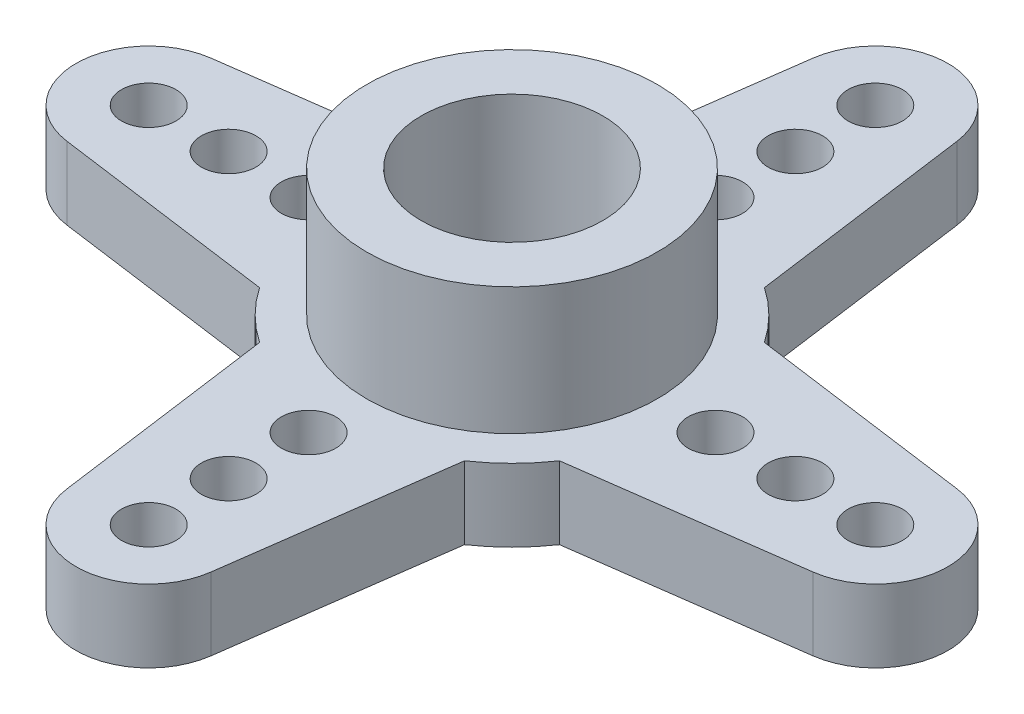
from build123d import *

# Parameters (mm, degrees)
ESBO_O2_R                = 0.75
RESSALTO_EXTRUS_O1_DEPTH = 2
PADR_OCIRCULAR1_COUNT    = 4
ESBO_O3_R                = 4
ESBO_O3_R_2              = 2.5
RESSALTO_EXTRUS_O2_DEPTH = 3.5
CORTE_EXTRUS_O1_START    = -1
ESBO_O4_R                = 2.5
ESBO_O4_R_2              = 0.75
CORTE_EXTRUS_O1_DEPTH    = 1
RESSALTO_EXTRUS_O3_START = 1
ESBO_O5_R                = 3
ESBO_O5_R_2              = 2.5
RESSALTO_EXTRUS_O3_DEPTH = 1


with BuildPart() as part:
    # Esboço2 → Ressalto-extrusão1 (new body)
    with BuildSketch(Plane(origin=(0, 0, 0), x_dir=(1, 0, 0), z_dir=(0, 1, 0))):
        with BuildLine():
            Line((-10.270723649, 1.981592467), (-4.128356106, 2.82075803))
            ThreePointArc((-4.128356106, 2.82075803), (-2.520023904, 4.318504316), (-0.424825461, 4.981919643))
            ThreePointArc((-0.424825461, 4.981919643), (0, 4.85), (0.424825461, 4.981919643))
            ThreePointArc((0.424825461, 4.981919643), (3.535533906, 3.535533906), (4.981919643, 0.424825461))
            ThreePointArc((4.981919643, 0.424825461), (4.85, 0), (4.981919643, -0.424825461))
            ThreePointArc((4.981919643, -0.424825461), (3.535533906, -3.535533906), (0.424825461, -4.981919643))
            ThreePointArc((0.424825461, -4.981919643), (0, -4.85), (-0.424825461, -4.981919643))
            ThreePointArc((-0.424825461, -4.981919643), (-2.520023904, -4.318504316), (-4.128356106, -2.82075803))
            Line((-4.128356106, -2.82075803), (-10.270723649, -1.981592467))
            ThreePointArc((-10.270723649, -1.981592467), (-12, 0), (-10.270723649, 1.981592467))
        make_face()
        with Locations(Location((0, 0, 0), (0, 0, 270))):
            Circle(ESBO_O2_R, mode=Mode.SUBTRACT)
        with Locations(Location((-5.6, 0, 0), (0, 0, 270))):
            Circle(ESBO_O2_R, mode=Mode.SUBTRACT)
        with Locations(Location((-7.8, 0, 0), (0, 0, 270))):
            Circle(ESBO_O2_R, mode=Mode.SUBTRACT)
        with Locations(Location((-10, 0, 0), (0, 0, 270))):
            Circle(ESBO_O2_R, mode=Mode.SUBTRACT)
    ressalto_extrus_o1 = extrude(amount=RESSALTO_EXTRUS_O1_DEPTH)

    # PadrãoCircular1: Ressalto-extrusão1 ×4 about axis
    padr_ocircular1_axis = Axis((0, 0, 0), (0, 1, 0))
    for i in range(1, PADR_OCIRCULAR1_COUNT):
        add(ressalto_extrus_o1.rotate(padr_ocircular1_axis, i * 360 / PADR_OCIRCULAR1_COUNT))

    # Esboço3 → Ressalto-extrusão2 (add)
    with BuildSketch(Plane(origin=(0, 2, 0), x_dir=(1, 0, 0), z_dir=(0, 1, 0))):
        with Locations(Location((0, 0, 0), (0, 0, 270))):
            Circle(ESBO_O3_R)
        with Locations(Location((0, 0, 0), (0, 0, 270))):
            Circle(ESBO_O3_R_2, mode=Mode.SUBTRACT)
    extrude(amount=RESSALTO_EXTRUS_O2_DEPTH)

    # Esboço4 → Corte-extrusão1 (cut)
    with BuildSketch(Plane(origin=(0, 2, 0), x_dir=(1, 0, 0), z_dir=(0, 1, 0)).offset(CORTE_EXTRUS_O1_START)):
        with Locations(Location((0, 0, 0), (0, 0, 270))):
            Circle(ESBO_O4_R)
        with Locations(Location((0, 0, 0), (0, 0, 270))):
            Circle(ESBO_O4_R_2, mode=Mode.SUBTRACT)
    extrude(amount=CORTE_EXTRUS_O1_DEPTH, mode=Mode.SUBTRACT)

    # Esboço5 → Ressalto-extrusão3 (add)
    with BuildSketch(Plane.XZ.offset(RESSALTO_EXTRUS_O3_START)):
        with Locations(Location((0, 0, 0), (0, 0, 90))):
            Circle(ESBO_O5_R)
        with Locations(Location((0, 0, 0), (0, 0, 90))):
            Circle(ESBO_O5_R_2, mode=Mode.SUBTRACT)
    extrude(amount=-RESSALTO_EXTRUS_O3_DEPTH)


solid = part.part
